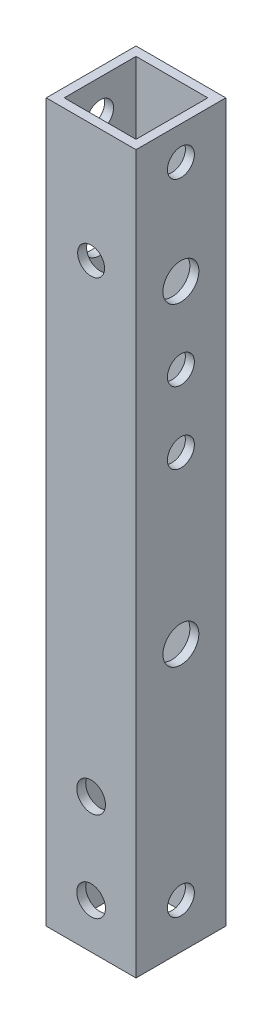
from build123d import *

# Parameters (mm, degrees)
SKETCH_1_W          = 10
SKETCH_1_H          = 10
SKETCH_1_W_2        = 8
SKETCH_1_H_2        = 8
EXTRUDE_1_DEPTH     = 104.9
SKETCH_2_R          = 1.6
SKETCH_2_R_2        = 1.5
CUT_EXTRUDE_1_DEPTH = 106.494123059
SKETCH_3_R          = 1.5
SKETCH_3_R_2        = 2
CUT_EXTRUDE_2_DEPTH = 106.494123059
SKETCH_4_W          = 10
SKETCH_4_H          = 10
CUT_EXTRUDE_3_DEPTH = 25


with BuildPart() as part:
    # ｽｹｯﾁ1 → 押し出し-薄板1 (new body)
    with BuildSketch(Plane(origin=(0, 0, 0), x_dir=(1, 0, 0), z_dir=(0, 1, 0))):
        Rectangle(SKETCH_1_W, SKETCH_1_H)
        Rectangle(SKETCH_1_W_2, SKETCH_1_H_2, mode=Mode.SUBTRACT)
    extrude(amount=EXTRUDE_1_DEPTH)

    # ｽｹｯﾁ2 → ｶｯﾄ - 押し出し1 (cut, through all)
    with BuildSketch(Plane.XY.offset(5)):
        with Locations((0, 5)):
            Circle(SKETCH_2_R)
        with Locations((0, 15)):
            Circle(SKETCH_2_R)
        with Locations((0, 92.95)):
            Circle(SKETCH_2_R_2)
        with Locations((0, 66.7)):
            Circle(SKETCH_2_R_2)
        with Locations((0, 99.9)):
            Circle(SKETCH_2_R_2)
    extrude(amount=-CUT_EXTRUDE_1_DEPTH, mode=Mode.SUBTRACT)

    # ｽｹｯﾁ3 → ｶｯﾄ - 押し出し2 (cut, through all)
    with BuildSketch(Plane(origin=(5, 0, 0), x_dir=(0, 0, -1), z_dir=(1, 0, 0))):
        with Locations((0, 76.2)):
            Circle(SKETCH_3_R)
        with Locations((0, 5)):
            Circle(SKETCH_3_R)
        with Locations((0, 64.7)):
            Circle(SKETCH_3_R_2)
        with Locations((0, 29.7)):
            Circle(SKETCH_3_R_2)
        with Locations((0, 48.2)):
            Circle(SKETCH_3_R)
        with Locations((0, 56.2)):
            Circle(SKETCH_3_R)
    extrude(amount=-CUT_EXTRUDE_2_DEPTH, mode=Mode.SUBTRACT)

    # ｽｹｯﾁ4 → ｶｯﾄ - 押し出し3 (cut)
    with BuildSketch(Plane(origin=(0, 104.9, 0), x_dir=(1, 0, 0), z_dir=(0, 1, 0))):
        Rectangle(SKETCH_4_W, SKETCH_4_H)
    extrude(amount=-CUT_EXTRUDE_3_DEPTH, mode=Mode.SUBTRACT)


solid = part.part
